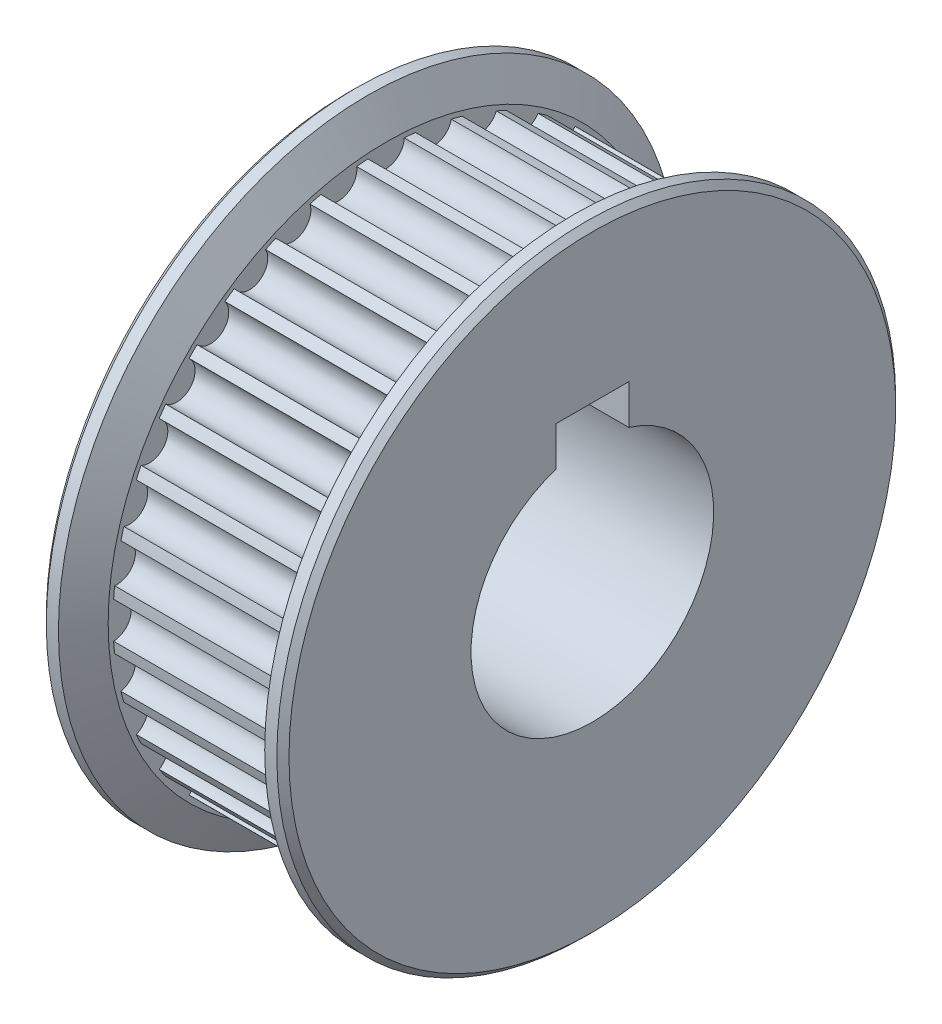
from build123d import *

# Parameters (mm, degrees)
SCHIZZO5_R                    = 0.75
TAGLIO_ESTRUSIONE1_DEPTH      = 7
TAGLIO_ESTRUSIONE2_REACH      = 26.782
TAGLIO_ESTRUSIONE2_END_RADIUS = 8
SCHIZZO6_R                    = 1.5
TAGLIO_ESTRUSIONE3_REACH      = 26.782
TAGLIO_ESTRUSIONE3_END_RADIUS = 8
SCHIZZO7_R                    = 1.5
SMUSSO1_SIZE                  = 0.5
SMUSSO2_SIZE                  = 0.25
SCHIZZO8_R                    = 5
TAGLIO_ESTRUSIONE4_DEPTH      = 25.781545622
TAGLIO_ESTRUSIONE5_START      = -7
SCHIZZO9_R                    = 8
TAGLIO_ESTRUSIONE5_DEPTH      = 7
TAGLIO_ESTRUSIONE6_DEPTH      = 30.654470544
TAGLIO_ESTRUSIONE6_DEPTH_BACK = 7
SCHIZZO10_W                   = 3
SCHIZZO10_H                   = 1.630303993


with BuildPart() as part:
    # Schizzo4 → Rivoluzione1 (revolve)
    with BuildSketch(Plane.XY, mode=Mode.PRIVATE) as rivoluzione1_sk:
        Polygon((0, 2.5), (0, 8), (7, 8), (7, 12.75), (7.75, 12.75), (8.5, 11.450961894), (8.5, 11.25), (15.5, 11.25), (15.5, 11.450961894), (16.25, 12.75), (17, 12.75), (17, 2.5), align=None)
    revolve(rivoluzione1_sk.sketch.rotate(Axis((0, 0, 0), (1, 0, 0)), 90), axis=Axis((0, 0, 0), (1, 0, 0)))

    # Schizzo5 → Taglio-Estrusione1 (cut)
    with BuildSketch(Plane(origin=(8.5, 0, 0), x_dir=(0, 0, -1), z_dir=(1, 0, 0))):
        with Locations((0, 11.25)):
            Circle(SCHIZZO5_R)
        with Locations((1.953541999, 11.079087221)):
            Circle(SCHIZZO5_R)
        with Locations((3.847726612, 10.571541984)):
            Circle(SCHIZZO5_R)
        with Locations((5.625, 9.742785793)):
            Circle(SCHIZZO5_R)
        with Locations((7.231360609, 8.617999985)):
            Circle(SCHIZZO5_R)
        with Locations((8.617999985, 7.231360609)):
            Circle(SCHIZZO5_R)
        with Locations((9.742785793, 5.625)):
            Circle(SCHIZZO5_R)
        with Locations((10.571541984, 3.847726612)):
            Circle(SCHIZZO5_R)
        with Locations((11.079087221, 1.953541999)):
            Circle(SCHIZZO5_R)
        with Locations((11.25, 0)):
            Circle(SCHIZZO5_R)
        with Locations((11.079087221, -1.953541999)):
            Circle(SCHIZZO5_R)
        with Locations((10.571541984, -3.847726612)):
            Circle(SCHIZZO5_R)
        with Locations((9.742785793, -5.625)):
            Circle(SCHIZZO5_R)
        with Locations((8.617999985, -7.231360609)):
            Circle(SCHIZZO5_R)
        with Locations((7.231360609, -8.617999985)):
            Circle(SCHIZZO5_R)
        with Locations((5.625, -9.742785793)):
            Circle(SCHIZZO5_R)
        with Locations((3.847726612, -10.571541984)):
            Circle(SCHIZZO5_R)
        with Locations((1.953541999, -11.079087221)):
            Circle(SCHIZZO5_R)
        with Locations((0, -11.25)):
            Circle(SCHIZZO5_R)
        with Locations((-1.953541999, -11.079087221)):
            Circle(SCHIZZO5_R)
        with Locations((-3.847726612, -10.571541984)):
            Circle(SCHIZZO5_R)
        with Locations((-5.625, -9.742785793)):
            Circle(SCHIZZO5_R)
        with Locations((-7.231360609, -8.617999985)):
            Circle(SCHIZZO5_R)
        with Locations((-8.617999985, -7.231360609)):
            Circle(SCHIZZO5_R)
        with Locations((-9.742785793, -5.625)):
            Circle(SCHIZZO5_R)
        with Locations((-10.571541984, -3.847726612)):
            Circle(SCHIZZO5_R)
        with Locations((-11.079087221, -1.953541999)):
            Circle(SCHIZZO5_R)
        with Locations((-11.25, 0)):
            Circle(SCHIZZO5_R)
        with Locations((-11.079087221, 1.953541999)):
            Circle(SCHIZZO5_R)
        with Locations((-10.571541984, 3.847726612)):
            Circle(SCHIZZO5_R)
        with Locations((-9.742785793, 5.625)):
            Circle(SCHIZZO5_R)
        with Locations((-8.617999985, 7.231360609)):
            Circle(SCHIZZO5_R)
        with Locations((-7.231360609, 8.617999985)):
            Circle(SCHIZZO5_R)
        with Locations((-5.625, 9.742785793)):
            Circle(SCHIZZO5_R)
        with Locations((-3.847726612, 10.571541984)):
            Circle(SCHIZZO5_R)
        with Locations((-1.953541999, 11.079087221)):
            Circle(SCHIZZO5_R)
    extrude(amount=TAGLIO_ESTRUSIONE1_DEPTH, mode=Mode.SUBTRACT)

    # Taglio-Estrusione2: up to this cylinder (the profile starts inside it)
    taglio_estrusione2_end = Plane(origin=(3.5, 0, 0), z_dir=(-1, 0, 0)) * Cylinder(TAGLIO_ESTRUSIONE2_END_RADIUS, 70.564, mode=Mode.PRIVATE)
    # Schizzo6 → Taglio-Estrusione2 (cut, up to the surface)
    with BuildSketch(Plane.XY, mode=Mode.PRIVATE) as taglio_estrusione2_sk1:
        with Locations(Location((3.5, 0, 0), (0, 0, 180))):
            Circle(SCHIZZO6_R)
    taglio_estrusione2_tool1 = extrude(taglio_estrusione2_sk1.sketch, amount=TAGLIO_ESTRUSIONE2_REACH, mode=Mode.PRIVATE) & taglio_estrusione2_end
    add(taglio_estrusione2_tool1.solids().sort_by_distance((3.5, 0, 0))[0], mode=Mode.SUBTRACT)

    # Taglio-Estrusione3: up to this cylinder (the profile starts inside it)
    taglio_estrusione3_end = Plane(origin=(3.5, 0, 0), z_dir=(-1, 0, 0)) * Cylinder(TAGLIO_ESTRUSIONE3_END_RADIUS, 70.564, mode=Mode.PRIVATE)
    # Schizzo7 → Taglio-Estrusione3 (cut, up to the surface)
    with BuildSketch(Plane(origin=(0, 0, 0), x_dir=(1, 0, 0), z_dir=(0, 1, 0)), mode=Mode.PRIVATE) as taglio_estrusione3_sk1:
        with Locations(Location((3.5, 0, 0), (0, 0, 90))):
            Circle(SCHIZZO7_R)
    taglio_estrusione3_tool1 = extrude(taglio_estrusione3_sk1.sketch, amount=TAGLIO_ESTRUSIONE3_REACH, mode=Mode.PRIVATE) & taglio_estrusione3_end
    add(taglio_estrusione3_tool1.solids().sort_by_distance((3.5, 0, 0))[0], mode=Mode.SUBTRACT)

    # Smusso1
    smusso1_edges = [part.edges().sort_by_distance(p)[0] for p in [
        (0, 0, -8),
        (0, 0, -2.5),
    ]]
    chamfer(smusso1_edges, length=SMUSSO1_SIZE)

    # Smusso2
    smusso2_edges = [part.edges().sort_by_distance(p)[0] for p in [
        (7, 0, -12.75),
        (17, 0, -12.75),
    ]]
    chamfer(smusso2_edges, length=SMUSSO2_SIZE)

    # Schizzo8 → Taglio-Estrusione4 (cut, through all)
    with BuildSketch(Plane.ZY):
        Circle(SCHIZZO8_R)
    extrude(amount=-TAGLIO_ESTRUSIONE4_DEPTH, mode=Mode.SUBTRACT)

    # Schizzo9 → Taglio-Estrusione5 (cut)
    with BuildSketch(Plane.ZY.offset(TAGLIO_ESTRUSIONE5_START)):
        Circle(SCHIZZO9_R)
    extrude(amount=TAGLIO_ESTRUSIONE5_DEPTH, mode=Mode.SUBTRACT)

    # Schizzo10 → Taglio-Estrusione6 (cut, two sides: drawn at the far end of the back side and taken through both)
    with BuildSketch(Plane(origin=(15.5, 3.134798291, -10.804422228), x_dir=(0, 0, 1), z_dir=(-1, 0, 0)).offset(-TAGLIO_ESTRUSIONE6_DEPTH_BACK)):
        with Locations((10.804422228, 2.450049713)):
            Rectangle(SCHIZZO10_W, SCHIZZO10_H)
    extrude(amount=TAGLIO_ESTRUSIONE6_DEPTH + TAGLIO_ESTRUSIONE6_DEPTH_BACK, mode=Mode.SUBTRACT)


solid = part.part
